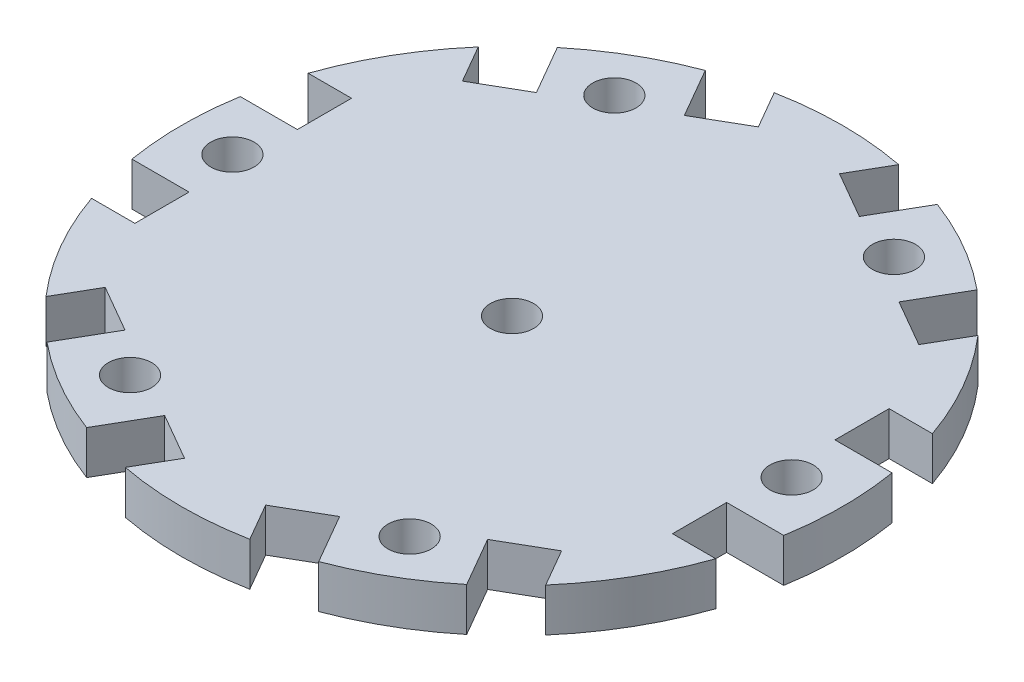
from build123d import *

# Parameters (mm, degrees)
CROQUIS1_R              = 30.5
SALIENTE_EXTRUIR1_DEPTH = 4
CROQUIS2_R              = 2
CORTAR_EXTRUIR1_DEPTH   = 4
CORTAR_EXTRUIR3_START   = -4
CORTAR_EXTRUIR3_DEPTH   = 4
CORTAR_EXTRUIR4_DEPTH   = 10


with BuildPart() as part:
    # Croquis1 → Saliente-Extruir1 (new body)
    with BuildSketch(Plane(origin=(0, 0, 0), x_dir=(1, 0, 0), z_dir=(0, 1, 0))):
        with Locations(Location((0, 0, 0), (0, 0, 270))):
            Circle(CROQUIS1_R)
    extrude(amount=SALIENTE_EXTRUIR1_DEPTH)

    # Croquis2 → Cortar-Extruir1 (cut)
    with BuildSketch(Plane(origin=(0, 4, 0), x_dir=(1, 0, 0), z_dir=(0, 1, 0))):
        with Locations(Location((0, 0, 0), (0, 0, 270))):
            Circle(CROQUIS2_R)
    extrude(amount=-CORTAR_EXTRUIR1_DEPTH, mode=Mode.SUBTRACT)

    # Croquis5 → Cortar-Extruir3 (cut)
    with BuildSketch(Plane(origin=(0, 4, 0), x_dir=(1, 0, 0), z_dir=(0, 1, 0)).offset(CORTAR_EXTRUIR3_START)):
        with BuildLine():
            ThreePointArc((-28.814059068, 10), (-29.556634924, 7.526973624), (-30.087372767, 5))
            Line((-30.087372767, 5), (-28.814059068, 5))
            Line((-28.814059068, 5), (-24.814059068, 5))
            Line((-24.814059068, 5), (-24.814059068, 10))
            Line((-24.814059068, 10), (-28.814059068, 10))
        make_face()
        with BuildLine():
            Line((28.814059068, 5), (30.087372767, 5))
            ThreePointArc((30.087372767, 5), (29.556634924, 7.526973624), (28.814059068, 10))
            Line((28.814059068, 10), (24.814059068, 10))
            Line((24.814059068, 10), (24.814059068, 5))
            Line((24.814059068, 5), (28.814059068, 5))
        make_face()
        with BuildLine():
            Line((30.087372767, -5), (28.814059068, -5))
            Line((28.814059068, -5), (24.814059068, -5))
            Line((24.814059068, -5), (24.814059068, -10))
            Line((24.814059068, -10), (28.814059068, -10))
            ThreePointArc((28.814059068, -10), (29.556634924, -7.526973624), (30.087372767, -5))
        make_face()
        with BuildLine():
            ThreePointArc((19.373813402, -23.556429149), (21.296867835, -21.833309883), (23.067283572, -19.953707139))
            Line((23.067283572, -19.953707139), (21.067283572, -16.489605524))
            Line((21.067283572, -16.489605524), (16.737156553, -18.989605524))
            Line((16.737156553, -18.989605524), (18.737156553, -22.453707139))
            Line((18.737156553, -22.453707139), (19.373813402, -23.556429149))
        make_face()
        with BuildLine():
            ThreePointArc((5.746775496, -29.953707139), (8.25976709, -29.360283507), (10.713559364, -28.556429149))
            Line((10.713559364, -28.556429149), (10.076902515, -27.453707139))
            Line((10.076902515, -27.453707139), (8.076902515, -23.989605524))
            Line((8.076902515, -23.989605524), (3.746775496, -26.489605524))
            Line((3.746775496, -26.489605524), (5.746775496, -29.953707139))
        make_face()
        with BuildLine():
            ThreePointArc((-10.713559364, -28.556429149), (-8.25976709, -29.360283507), (-5.746775496, -29.953707139))
            Line((-5.746775496, -29.953707139), (-3.746775496, -26.489605524))
            Line((-3.746775496, -26.489605524), (-8.076902515, -23.989605524))
            Line((-8.076902515, -23.989605524), (-10.076902515, -27.453707139))
            Line((-10.076902515, -27.453707139), (-10.713559364, -28.556429149))
        make_face()
        with BuildLine():
            ThreePointArc((-23.067283572, -19.953707139), (-21.296867835, -21.833309883), (-19.373813402, -23.556429149))
            Line((-19.373813402, -23.556429149), (-18.737156553, -22.453707139))
            Line((-18.737156553, -22.453707139), (-16.737156553, -18.989605524))
            Line((-16.737156553, -18.989605524), (-21.067283572, -16.489605524))
            Line((-21.067283572, -16.489605524), (-23.067283572, -19.953707139))
        make_face()
        with BuildLine():
            ThreePointArc((-30.087372767, -5), (-29.556634924, -7.526973624), (-28.814059068, -10))
            Line((-28.814059068, -10), (-24.814059068, -10))
            Line((-24.814059068, -10), (-24.814059068, -5))
            Line((-24.814059068, -5), (-28.814059068, -5))
            Line((-28.814059068, -5), (-30.087372767, -5))
        make_face()
        with BuildLine():
            Line((-18.737156553, 22.453707139), (-19.373813402, 23.556429149))
            ThreePointArc((-19.373813402, 23.556429149), (-21.296867835, 21.833309883), (-23.067283572, 19.953707139))
            Line((-23.067283572, 19.953707139), (-21.067283572, 16.489605524))
            Line((-21.067283572, 16.489605524), (-16.737156553, 18.989605524))
            Line((-16.737156553, 18.989605524), (-18.737156553, 22.453707139))
        make_face()
        with BuildLine():
            Line((-3.746775496, 26.489605524), (-5.746775496, 29.953707139))
            ThreePointArc((-5.746775496, 29.953707139), (-8.25976709, 29.360283507), (-10.713559364, 28.556429149))
            Line((-10.713559364, 28.556429149), (-10.076902515, 27.453707139))
            Line((-10.076902515, 27.453707139), (-8.076902515, 23.989605524))
            Line((-8.076902515, 23.989605524), (-3.746775496, 26.489605524))
        make_face()
        with BuildLine():
            Line((10.076902515, 27.453707139), (10.713559364, 28.556429149))
            ThreePointArc((10.713559364, 28.556429149), (8.25976709, 29.360283507), (5.746775496, 29.953707139))
            Line((5.746775496, 29.953707139), (3.746775496, 26.489605524))
            Line((3.746775496, 26.489605524), (8.076902515, 23.989605524))
            Line((8.076902515, 23.989605524), (10.076902515, 27.453707139))
        make_face()
        with BuildLine():
            Line((21.067283572, 16.489605524), (23.067283572, 19.953707139))
            ThreePointArc((23.067283572, 19.953707139), (21.296867835, 21.833309883), (19.373813402, 23.556429149))
            Line((19.373813402, 23.556429149), (18.737156553, 22.453707139))
            Line((18.737156553, 22.453707139), (16.737156553, 18.989605524))
            Line((16.737156553, 18.989605524), (21.067283572, 16.489605524))
        make_face()
    extrude(amount=CORTAR_EXTRUIR3_DEPTH, mode=Mode.SUBTRACT)

    # Croquis7 → Cortar-Extruir4 (cut)
    with BuildSketch(Plane(origin=(0, 4, 0), x_dir=(1, 0, 0), z_dir=(0, 1, 0))):
        with BuildLine():
            ThreePointArc((-13.907029535, 20.623580122), (-11.907029535, 20.623580122), (-10.907029535, 22.355630929))
            Line((-10.907029535, 22.355630929), (-12.907029535, 22.355630929))
            Line((-12.907029535, 22.355630929), (-13.907029535, 20.623580122))
        make_face()
        with BuildLine():
            Line((-12.907029535, 22.355630929), (-10.907029535, 22.355630929))
            ThreePointArc((-10.907029535, 22.355630929), (-13.907029535, 24.087681737), (-13.907029535, 20.623580122))
            Line((-13.907029535, 20.623580122), (-12.907029535, 22.355630929))
        make_face()
        with BuildLine():
            ThreePointArc((-23.81405907, 0), (-24.082008262, 1), (-24.81405907, 1.732050808))
            Line((-24.81405907, 1.732050808), (-25.81405907, 0))
            Line((-25.81405907, 0), (-24.81405907, -1.732050808))
            ThreePointArc((-24.81405907, -1.732050808), (-24.082008262, -1), (-23.81405907, 0))
        make_face()
        with BuildLine():
            Line((-25.81405907, 0), (-24.81405907, 1.732050808))
            ThreePointArc((-24.81405907, 1.732050808), (-27.81405907, 0), (-24.81405907, -1.732050808))
            Line((-24.81405907, -1.732050808), (-25.81405907, 0))
        make_face()
        with BuildLine():
            ThreePointArc((10.907029535, 22.355630929), (11.907029535, 20.623580122), (13.907029535, 20.623580122))
            Line((13.907029535, 20.623580122), (12.907029535, 22.355630929))
            Line((12.907029535, 22.355630929), (10.907029535, 22.355630929))
        make_face()
        with BuildLine():
            Line((12.907029535, 22.355630929), (13.907029535, 20.623580122))
            ThreePointArc((13.907029535, 20.623580122), (14.639080343, 21.355630929), (14.907029535, 22.355630929))
            ThreePointArc((14.907029535, 22.355630929), (12.907029535, 24.355630929), (10.907029535, 22.355630929))
            Line((10.907029535, 22.355630929), (12.907029535, 22.355630929))
        make_face()
        with BuildLine():
            Line((24.81405907, -1.732050808), (25.81405907, 0))
            Line((25.81405907, 0), (24.81405907, 1.732050808))
            ThreePointArc((24.81405907, 1.732050808), (23.81405907, 0), (24.81405907, -1.732050808))
        make_face()
        with BuildLine():
            Line((24.81405907, 1.732050808), (25.81405907, 0))
            Line((25.81405907, 0), (24.81405907, -1.732050808))
            ThreePointArc((24.81405907, -1.732050808), (26.81405907, -1.732050808), (27.81405907, 0))
            ThreePointArc((27.81405907, 0), (26.81405907, 1.732050808), (24.81405907, 1.732050808))
        make_face()
        with BuildLine():
            ThreePointArc((-13.907029535, -20.623580122), (-13.907029535, -24.087681737), (-10.907029535, -22.355630929))
            Line((-10.907029535, -22.355630929), (-12.907029535, -22.355630929))
            Line((-12.907029535, -22.355630929), (-13.907029535, -20.623580122))
        make_face()
        with BuildLine():
            Line((-12.907029535, -22.355630929), (-10.907029535, -22.355630929))
            ThreePointArc((-10.907029535, -22.355630929), (-11.907029535, -20.623580122), (-13.907029535, -20.623580122))
            Line((-13.907029535, -20.623580122), (-12.907029535, -22.355630929))
        make_face()
        with BuildLine():
            ThreePointArc((14.907029535, -22.355630929), (14.639080343, -21.355630929), (13.907029535, -20.623580122))
            Line((13.907029535, -20.623580122), (12.907029535, -22.355630929))
            Line((12.907029535, -22.355630929), (10.907029535, -22.355630929))
            ThreePointArc((10.907029535, -22.355630929), (12.907029535, -24.355630929), (14.907029535, -22.355630929))
        make_face()
        with BuildLine():
            Line((12.907029535, -22.355630929), (13.907029535, -20.623580122))
            ThreePointArc((13.907029535, -20.623580122), (11.907029535, -20.623580122), (10.907029535, -22.355630929))
            Line((10.907029535, -22.355630929), (12.907029535, -22.355630929))
        make_face()
    extrude(amount=-CORTAR_EXTRUIR4_DEPTH, mode=Mode.SUBTRACT)


solid = part.part
